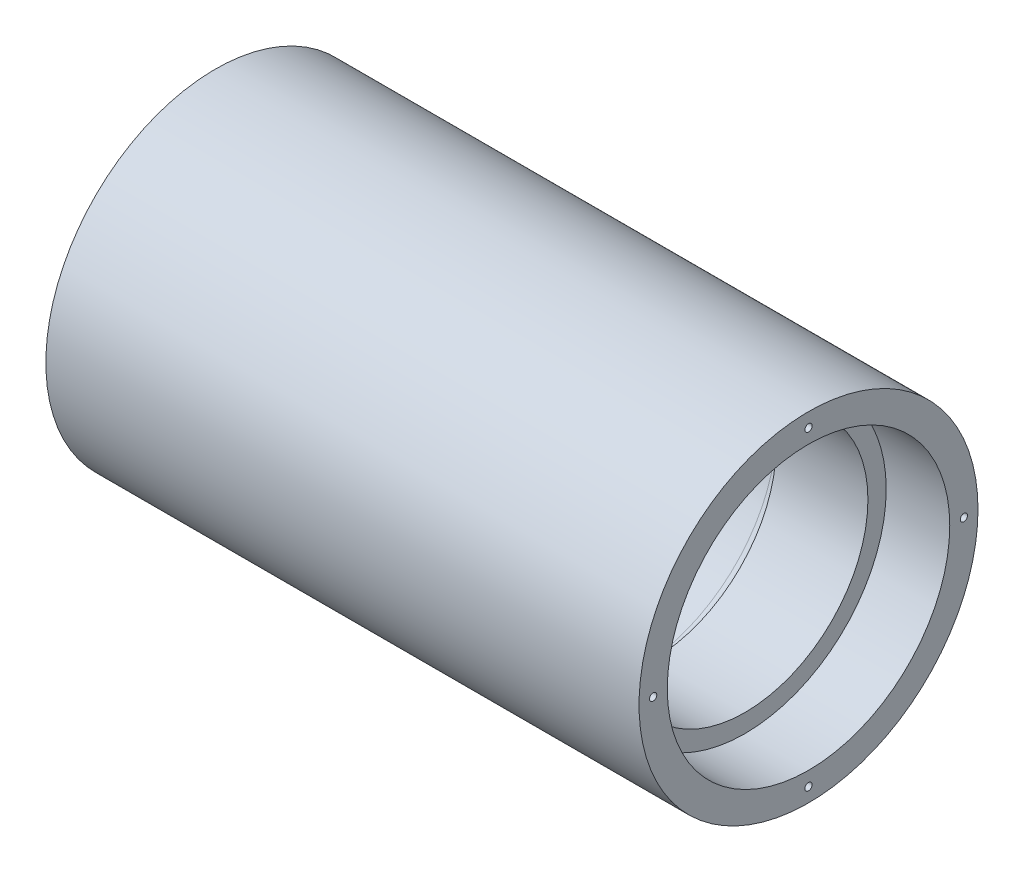
from build123d import *

# Parameters (mm, degrees)
BOSS_EXTRUDE1_DEPTH          = 84
BOSS_EXTRUDE1_DEPTH_BACK     = 84
SKETCH2_R                    = 48
CUT_EXTRUDE1_DEPTH           = 40
CUT_EXTRUDE1_DEPTH_BACK      = 50
SKETCH3_R                    = 40
CUT_EXTRUDE2_DEPTH           = 109
CUT_EXTRUDE2_DEPTH_BACK      = 109
SKETCH4_R                    = 31
FILLET1_R                    = 5
CUT_EXTRUDE3_REACH           = 176
CUT_EXTRUDE3_START           = -66
SKETCH5_R                    = 40
SKETCH6_R                    = 34
CUT_EXTRUDE4_DEPTH           = 18.4
M2_5X0_45_TAPPED_HOLE1_D     = 2.05
M2_5X0_45_TAPPED_HOLE1_DEPTH = 8
M2_5X0_45_TAPPED_HOLE1_TIP   = 0.615882135
M2_5X0_45_TAPPED_HOLE2_D     = 2.05
M2_5X0_45_TAPPED_HOLE2_DEPTH = 8
M2_5X0_45_TAPPED_HOLE2_TIP   = 0.615882135
CUT_EXTRUDE6_START           = -18
SKETCH14_R                   = 34.825
CUT_EXTRUDE6_DEPTH           = 26


with BuildPart() as part:
    # Sketch2 → Boss-Extrude1 (new, two sides: drawn at the far end of the back side and taken through both)
    with BuildSketch(Plane(origin=(0, 0, 0), x_dir=(0, -1, 0), z_dir=(1, 0, 0)).offset(-BOSS_EXTRUDE1_DEPTH_BACK)):
        with Locations(Location((0, 0, 0), (0, 0, 90))):
            Circle(SKETCH2_R)
    extrude(amount=BOSS_EXTRUDE1_DEPTH + BOSS_EXTRUDE1_DEPTH_BACK)

    # Sketch3 → Cut-Extrude1 (cut, two sides: drawn at the far end of the back side and taken through both)
    with BuildSketch(Plane(origin=(0, 0, 0), x_dir=(0, -1, 0), z_dir=(1, 0, 0)).offset(-CUT_EXTRUDE1_DEPTH_BACK)):
        with Locations(Location((0, 0, 0), (0, 0, 90))):
            Circle(SKETCH3_R)
    extrude(amount=CUT_EXTRUDE1_DEPTH + CUT_EXTRUDE1_DEPTH_BACK, mode=Mode.SUBTRACT)

    # Sketch4 → Cut-Extrude2 (cut, two sides: drawn at the far end of the back side and taken through both)
    with BuildSketch(Plane(origin=(0, 0, 0), x_dir=(0, -1, 0), z_dir=(1, 0, 0)).offset(-CUT_EXTRUDE2_DEPTH_BACK)):
        with Locations(Location((0, 0, 0), (0, 0, 90))):
            Circle(SKETCH4_R)
    extrude(amount=CUT_EXTRUDE2_DEPTH + CUT_EXTRUDE2_DEPTH_BACK, mode=Mode.SUBTRACT)

    # Fillet1
    fillet1_edges = [part.edges().sort_by_distance(p)[0] for p in [
        (40, 0, 40),
        (-50, 0, 40),
    ]]
    fillet(fillet1_edges, radius=FILLET1_R)

    # Sketch5 → Cut-Extrude3 (cut, up to next)
    with BuildSketch(Plane(origin=(0, 0, 0), x_dir=(0, 0, -1), z_dir=(-1, 0, 0)).offset(CUT_EXTRUDE3_START), mode=Mode.PRIVATE) as cut_extrude3_sk1:
        Circle(SKETCH5_R)
    cut_extrude3_tool1 = extrude(cut_extrude3_sk1.sketch, amount=-CUT_EXTRUDE3_REACH, mode=Mode.PRIVATE) & part.part
    add(cut_extrude3_tool1.solids().sort_by_distance((66, 0, 0))[0], mode=Mode.SUBTRACT)

    # Sketch6 → Cut-Extrude4 (cut)
    with BuildSketch(Plane.ZY.offset(84)):
        Circle(SKETCH6_R)
    extrude(amount=-CUT_EXTRUDE4_DEPTH, mode=Mode.SUBTRACT)

    # M2.5x0.45 Tapped Hole1
    with Locations(Plane(origin=(84, 0, 0), x_dir=(0, 0, -1), z_dir=(1, 0, 0))):
        with Locations((256.353874164, 80.103153953), (0, -44), (-44, 0), (0, 44), (44, 0)):
            Hole(M2_5X0_45_TAPPED_HOLE1_D / 2, depth=M2_5X0_45_TAPPED_HOLE1_DEPTH)
            with Locations((0, 0, -(M2_5X0_45_TAPPED_HOLE1_DEPTH + M2_5X0_45_TAPPED_HOLE1_TIP / 2))):  # 118° drill point
                Cone(0, M2_5X0_45_TAPPED_HOLE1_D / 2, M2_5X0_45_TAPPED_HOLE1_TIP, mode=Mode.SUBTRACT)

    # M2.5x0.45 Tapped Hole2
    with Locations(Plane.ZY.offset(84)):
        with Locations((0, 41), (0, -41), (41, 0), (-41, 0)):
            Hole(M2_5X0_45_TAPPED_HOLE2_D / 2, depth=M2_5X0_45_TAPPED_HOLE2_DEPTH)
            with Locations((0, 0, -(M2_5X0_45_TAPPED_HOLE2_DEPTH + M2_5X0_45_TAPPED_HOLE2_TIP / 2))):  # 118° drill point
                Cone(0, M2_5X0_45_TAPPED_HOLE2_D / 2, M2_5X0_45_TAPPED_HOLE2_TIP, mode=Mode.SUBTRACT)

    # Sketch14 → Cut-Extrude6 (cut)
    with BuildSketch(Plane(origin=(84, 0, 0), x_dir=(0, 0, -1), z_dir=(1, 0, 0)).offset(CUT_EXTRUDE6_START)):
        Circle(SKETCH14_R)
    extrude(amount=-CUT_EXTRUDE6_DEPTH, mode=Mode.SUBTRACT)


solid = part.part
